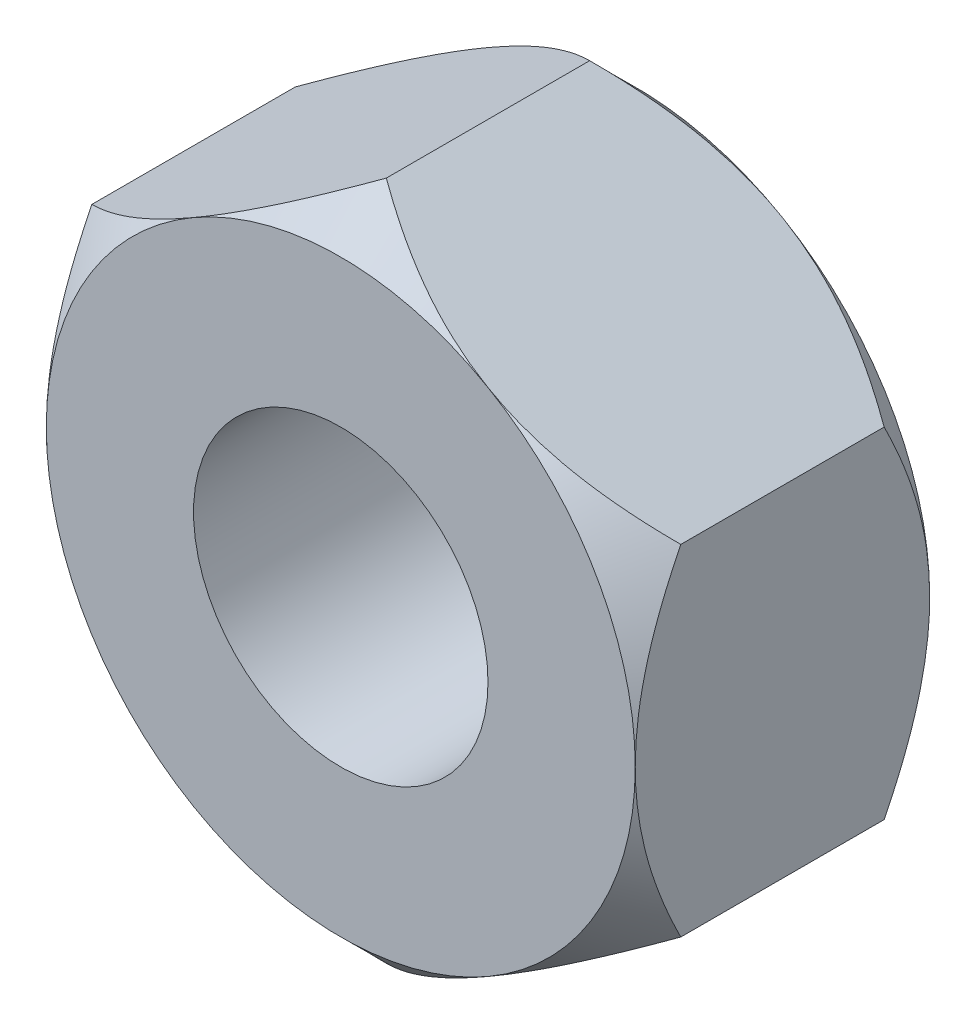
from build123d import *

# Parameters (mm, degrees)
EXTRUDE1_DEPTH    = 5
SKETCH2_R         = 5
EXTRUDE2_DEPTH    = 10
SKETCH3_OUTSIDE_W = 48.43
SKETCH3_OUTSIDE_H = 51.524
SKETCH3_OUTSIDE_R = 10
EXTRUDE4_DEPTH    = 10
EXTRUDE4_TAPER    = 45
SKETCH4_OUTSIDE_W = 48.43
SKETCH4_OUTSIDE_H = 51.524
SKETCH4_OUTSIDE_R = 10
EXTRUDE5_DEPTH    = 10
EXTRUDE5_TAPER    = 45


with BuildPart() as part:
    # Sketch1 → Extrude1 (new, symmetric)
    with BuildSketch(Plane.XY):
        Polygon((0, 11.547005384), (-10, 5.773502692), (-10, -5.773502692), (0, -11.547005384), (10, -5.773502692), (10, 5.773502692), align=None)
    extrude(amount=EXTRUDE1_DEPTH, both=True)

    # Sketch2 → Extrude2 (cut)
    with BuildSketch(Plane.XY.offset(5)):
        Circle(SKETCH2_R)
    extrude(amount=-EXTRUDE2_DEPTH, mode=Mode.SUBTRACT)

    # Sketch3 outside → Extrude4 (cut)
    with BuildSketch(Plane.XY.offset(5)):
        Rectangle(SKETCH3_OUTSIDE_W, SKETCH3_OUTSIDE_H)
        Circle(SKETCH3_OUTSIDE_R, mode=Mode.SUBTRACT)
    extrude(amount=-EXTRUDE4_DEPTH, taper=EXTRUDE4_TAPER, mode=Mode.SUBTRACT)

    # Sketch4 outside → Extrude5 (cut)
    with BuildSketch(Plane(origin=(0, 0, -5), x_dir=(-1, 0, 0), z_dir=(0, 0, -1))):
        Rectangle(SKETCH4_OUTSIDE_W, SKETCH4_OUTSIDE_H)
        Circle(SKETCH4_OUTSIDE_R, mode=Mode.SUBTRACT)
    extrude(amount=-EXTRUDE5_DEPTH, taper=EXTRUDE5_TAPER, mode=Mode.SUBTRACT)


solid = part.part
